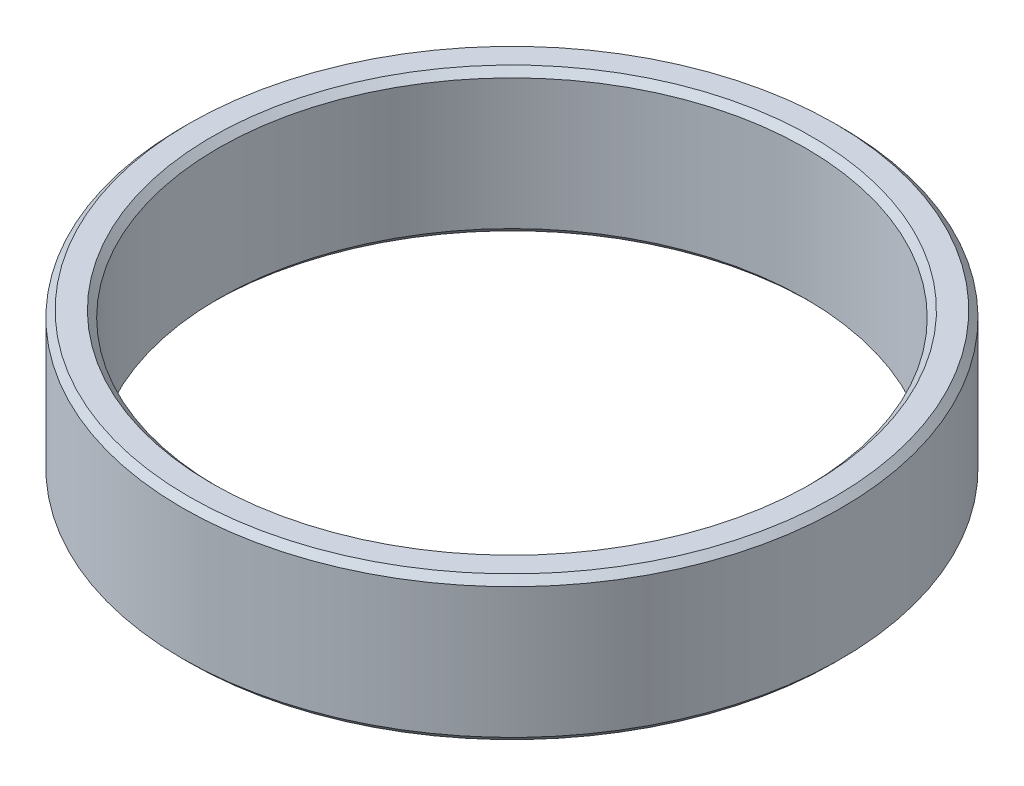
from build123d import *

# Parameters (mm, degrees)
SKETCH_1_R      = 50.5
SKETCH_1_R_2    = 45
EXTRUDE_1_DEPTH = 22
CHAMFER_1_SIZE  = 1


with BuildPart() as part:
    # 草图1 → 凸台-拉伸1 (new body)
    with BuildSketch(Plane(origin=(0, 0, 0), x_dir=(1, 0, 0), z_dir=(0, 1, 0))):
        with Locations(Location((0, 0, 0), (0, 0, 270))):
            Circle(SKETCH_1_R)
        with Locations(Location((0, 0, 0), (0, 0, 270))):
            Circle(SKETCH_1_R_2, mode=Mode.SUBTRACT)
    extrude(amount=EXTRUDE_1_DEPTH)

    # 倒角1
    chamfer_1_edges = [part.edges().sort_by_distance(p)[0] for p in [
        (0, 0, -50.5),
        (0, 22, -50.5),
        (0, 0, -45),
        (0, 22, -45),
    ]]
    chamfer(chamfer_1_edges, length=CHAMFER_1_SIZE)


solid = part.part
